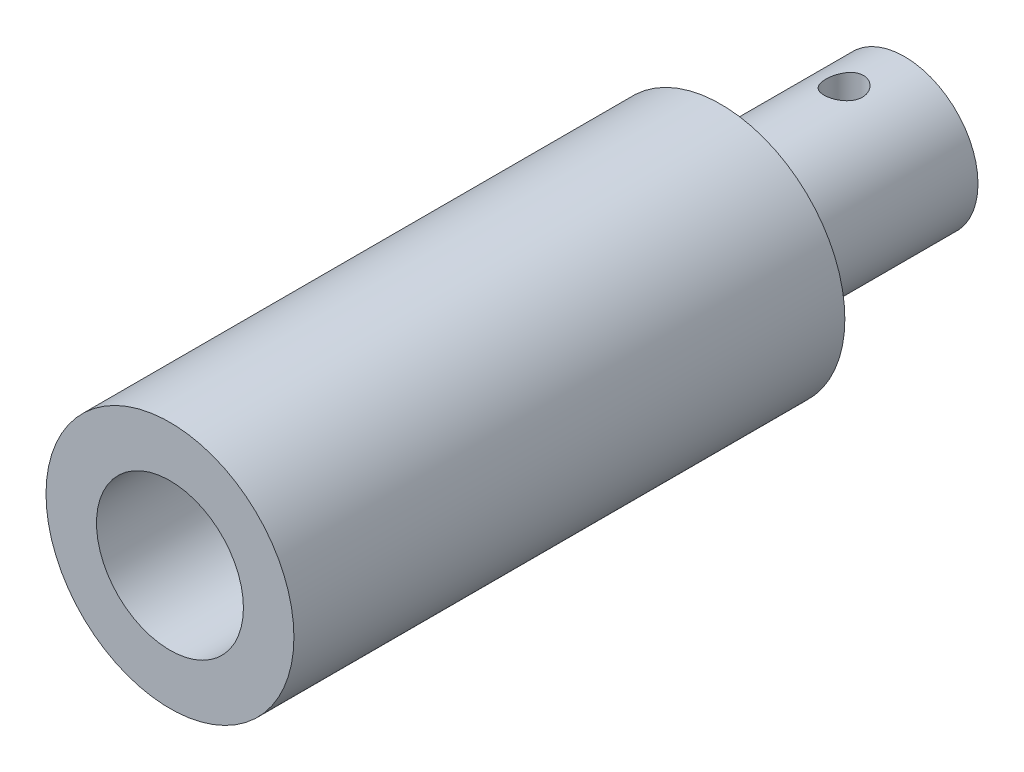
from build123d import *

# Parameters (mm, degrees)
SKETCH1_R           = 6.75
BOSS_EXTRUDE1_DEPTH = 30
SKETCH3_R           = 4
BOSS_EXTRUDE4_DEPTH = 10
SKETCH4_R           = 1
CUT_EXTRUDE2_DEPTH  = 15
SKETCH2_R           = 4
CUT_EXTRUDE3_DEPTH  = 25


with BuildPart() as part:
    # Sketch1 → Boss-Extrude1 (new body)
    with BuildSketch(Plane.XY):
        Circle(SKETCH1_R)
    extrude(amount=BOSS_EXTRUDE1_DEPTH)

    # Sketch3 → Boss-Extrude4 (add)
    with BuildSketch(Plane(origin=(0, 0, 0), x_dir=(-1, 0, 0), z_dir=(0, 0, -1))):
        with Locations(Location((0, 0, 0), (0, 0, 180))):
            Circle(SKETCH3_R)
    extrude(amount=BOSS_EXTRUDE4_DEPTH)

    # Sketch4 → Cut-Extrude2 (cut)
    with BuildSketch(Plane(origin=(0, 4, 0), x_dir=(1, 0, 0), z_dir=(0, 1, 0))):
        with Locations(Location((-0.291407977, 7, 0), (0, 0, 270))):
            Circle(SKETCH4_R)
    extrude(amount=-CUT_EXTRUDE2_DEPTH, mode=Mode.SUBTRACT)

    # Sketch2 → Cut-Extrude3 (cut)
    with BuildSketch(Plane.XY.offset(30)):
        Circle(SKETCH2_R)
    extrude(amount=-CUT_EXTRUDE3_DEPTH, mode=Mode.SUBTRACT)


solid = part.part
